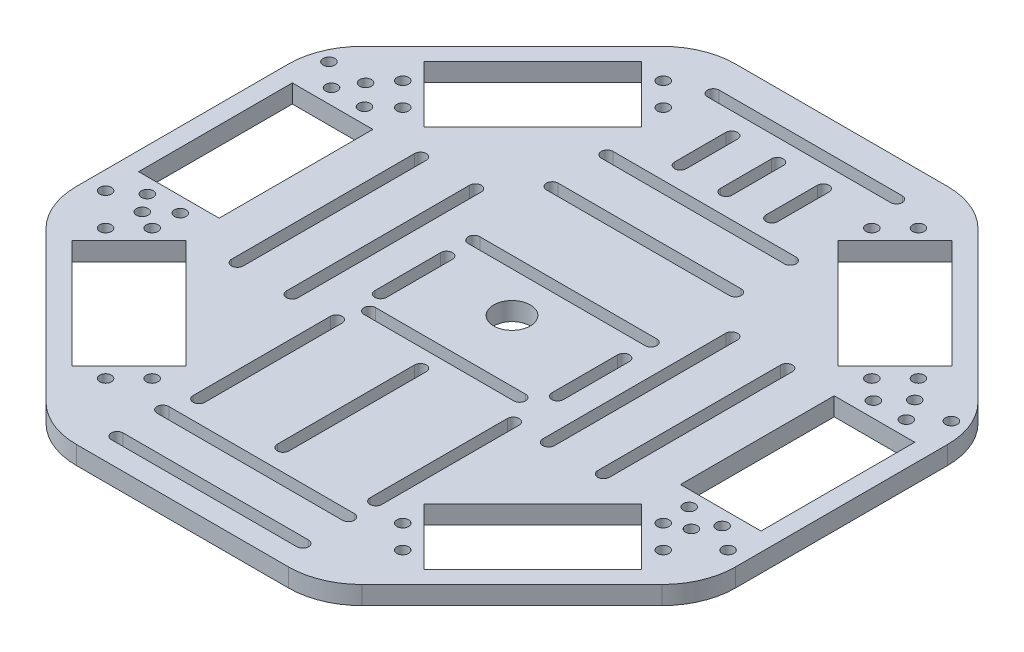
from build123d import *

# Parameters (mm, degrees)
BASEPLATE_DEPTH            = 5
FILLET1_R                  = 20
SKETCH2_R                  = 1.6
SKETCH2_W                  = 22
SKETCH2_H                  = 42
SERVO_HOLE_DEPTH           = 128.377392029
SKETCH3_R                  = 5
CENTER_HOLE_DEPTH          = 128.377392029
SERVO_HOLE_PATTERN_COUNT   = 8
SKETCH4_R                  = 1.6
ARDUINO_SCREW_HOLES_DEPTH  = 128.377392029
MIRROR1_COPY_1_SKETCH_R    = 1.6
MIRROR1_COPY_1_SKETCH_W    = 22
MIRROR1_COPY_1_SKETCH_H    = 42
MIRROR1_COPY_1_DEPTH       = 128.377392029
MIRROR1_COPY_2_SKETCH_R    = 1.6
MIRROR1_COPY_2_SKETCH_W    = 22
MIRROR1_COPY_2_SKETCH_H    = 42
MIRROR1_COPY_2_DEPTH       = 128.377392029
SLITS_DEPTH                = 128.377392029
SKETCH6_R                  = 1.6
EXTERIOR_SCREW_HOLES_DEPTH = 128.377392029
SKETCH7_R                  = 1.6
CUT_EXTRUDE1_DEPTH         = 128.377392029
CUT_EXTRUDE2_DEPTH         = 128.377392029


with BuildPart() as part:
    # Sketch1 → Baseplate (new body)
    with BuildSketch(Plane(origin=(0, 0, 0), x_dir=(1, 0, 0), z_dir=(0, 1, 0))):
        Polygon((-90, -37.279220614), (-37.279220614, -90), (37.279220614, -90), (90, -37.279220614), (90, 37.279220614), (37.279220614, 90), (-37.279220614, 90), (-90, 37.279220614), align=None)
    extrude(amount=BASEPLATE_DEPTH)

    # Fillet1
    fillet1_edges = [part.edges().sort_by_distance(p)[0] for p in [
        (-37.279220614, 2.5, -90),
        (37.279220614, 2.5, -90),
        (90, 2.5, -37.279220614),
        (90, 2.5, 37.279220614),
        (37.279220614, 2.5, 90),
        (-37.279220614, 2.5, 90),
        (-90, 2.5, 37.279220614),
        (-90, 2.5, -37.279220614),
    ]]
    fillet(fillet1_edges, radius=FILLET1_R)

    # Sketch2 → Servo hole (cut, through all)
    with BuildSketch(Plane(origin=(0, 5, 0), x_dir=(1, 0, 0), z_dir=(0, 1, 0))):
        with Locations(Location((78.5, 29.205050634, 0), (0, 0, 270))):
            Circle(SKETCH2_R)
        with Locations((74, 4.005050634)):
            Rectangle(SKETCH2_W, SKETCH2_H)
        with Locations(Location((69.5, -21.094949366, 0), (0, 0, 270))):
            Circle(SKETCH2_R)
        with Locations(Location((78.5, -21.094949366, 0), (0, 0, 270))):
            Circle(SKETCH2_R)
        with Locations(Location((69.5, 29.205050634, 0), (0, 0, 270))):
            Circle(SKETCH2_R)
    servo_hole = extrude(amount=-SERVO_HOLE_DEPTH, mode=Mode.SUBTRACT)

    # Sketch3 → Center hole (cut, through all)
    with BuildSketch(Plane(origin=(0, 5, 0), x_dir=(1, 0, 0), z_dir=(0, 1, 0))):
        with Locations(Location((0, 0, 0), (0, 0, 270))):
            Circle(SKETCH3_R)
    extrude(amount=-CENTER_HOLE_DEPTH, mode=Mode.SUBTRACT)

    # Servo hole pattern: Servo hole ×8 about axis, 5 skipped
    servo_hole_pattern_axis = Axis((0, 0, 0), (0, 1, 0))
    add([servo_hole.rotate(servo_hole_pattern_axis, i * 360 / SERVO_HOLE_PATTERN_COUNT) for i in range(1, SERVO_HOLE_PATTERN_COUNT) if i not in (2, 3, 4, 5, 6)], mode=Mode.SUBTRACT)

    # Sketch4 → Arduino Screw holes (cut, through all)
    with BuildSketch(Plane(origin=(0, 5, 0), x_dir=(1, 0, 0), z_dir=(0, 1, 0))):
        with Locations(Location((-23, 5.1332, 0), (0, 0, 270))):
            Circle(SKETCH4_R)
        with Locations(Location((-23, -70, 0), (0, 0, 270))):
            Circle(SKETCH4_R)
        with Locations(Location((25.3362, 12.6262, 0), (0, 0, 270))):
            Circle(SKETCH4_R)
        with Locations(Location((25.3362, -70, 0), (0, 0, 270))):
            Circle(SKETCH4_R)
        with Locations(Location((-7.55849277, -18.3745, 0), (0, 0, 270))):
            Circle(SKETCH4_R)
        with Locations(Location((20.45770723, -18.3745, 0), (0, 0, 270))):
            Circle(SKETCH4_R)
    extrude(amount=-ARDUINO_SCREW_HOLES_DEPTH, mode=Mode.SUBTRACT)

    # Mirror1: Servo hole across plane
    add(servo_hole.mirror(Plane(origin=(0, 0, 0), x_dir=(0, 0, 1), z_dir=(1, 0, 0))), mode=Mode.SUBTRACT)

    # Mirror1 copy 1 sketch → Mirror1 copy 1 (cut, through all)
    with BuildSketch(Plane(origin=(0, 5, 0), x_dir=(-0.7071067811865476, 0, -0.7071067811865475), z_dir=(0, 1, 0))):
        with Locations((78.5, -29.205050634)):
            Circle(MIRROR1_COPY_1_SKETCH_R)
        with Locations((74, -4.005050634)):
            Rectangle(MIRROR1_COPY_1_SKETCH_W, MIRROR1_COPY_1_SKETCH_H)
        with Locations((69.5, 21.094949366)):
            Circle(MIRROR1_COPY_1_SKETCH_R)
        with Locations((78.5, 21.094949366)):
            Circle(MIRROR1_COPY_1_SKETCH_R)
        with Locations((69.5, -29.205050634)):
            Circle(MIRROR1_COPY_1_SKETCH_R)
    extrude(amount=-MIRROR1_COPY_1_DEPTH, mode=Mode.SUBTRACT)

    # Mirror1 copy 2 sketch → Mirror1 copy 2 (cut, through all)
    with BuildSketch(Plane(origin=(0, 5, 0), x_dir=(-0.7071067811865474, 0, 0.7071067811865477), z_dir=(0, 1, 0))):
        with Locations((78.5, -29.205050634)):
            Circle(MIRROR1_COPY_2_SKETCH_R)
        with Locations((74, -4.005050634)):
            Rectangle(MIRROR1_COPY_2_SKETCH_W, MIRROR1_COPY_2_SKETCH_H)
        with Locations((69.5, 21.094949366)):
            Circle(MIRROR1_COPY_2_SKETCH_R)
        with Locations((78.5, 21.094949366)):
            Circle(MIRROR1_COPY_2_SKETCH_R)
        with Locations((69.5, -29.205050634)):
            Circle(MIRROR1_COPY_2_SKETCH_R)
    extrude(amount=-MIRROR1_COPY_2_DEPTH, mode=Mode.SUBTRACT)

    # Sketch5 → Slits (cut, through all)
    with BuildSketch(Plane(origin=(0, 5, 0), x_dir=(1, 0, 0), z_dir=(0, 1, 0))):
        with BuildLine():
            Line((-1.6, 72.5), (-1.6, 58.5))
            ThreePointArc((-1.6, 58.5), (0, 56.9), (1.6, 58.5))
            Line((1.6, 58.5), (1.6, 72.5))
            ThreePointArc((1.6, 72.5), (0, 74.1), (-1.6, 72.5))
        make_face()
        with BuildLine():
            Line((10.9, 72.5), (10.9, 58.5))
            ThreePointArc((10.9, 58.5), (12.5, 56.9), (14.1, 58.5))
            Line((14.1, 58.5), (14.1, 72.5))
            ThreePointArc((14.1, 72.5), (12.5, 74.1), (10.9, 72.5))
        make_face()
        with BuildLine():
            Line((-25, 49.4), (25, 49.4))
            ThreePointArc((25, 49.4), (26.6, 51), (25, 52.6))
            Line((25, 52.6), (-25, 52.6))
            ThreePointArc((-25, 52.6), (-26.6, 51), (-25, 49.4))
        make_face()
        with BuildLine():
            Line((-25, 34.4), (25, 34.4))
            ThreePointArc((25, 34.4), (26.6, 36), (25, 37.6))
            Line((25, 37.6), (-25, 37.6))
            ThreePointArc((-25, 37.6), (-26.6, 36), (-25, 34.4))
        make_face()
        with BuildLine():
            Line((-51.6, 25), (-51.6, -25))
            ThreePointArc((-51.6, -25), (-50, -26.6), (-48.4, -25))
            Line((-48.4, -25), (-48.4, 25))
            ThreePointArc((-48.4, 25), (-50, 26.6), (-51.6, 25))
        make_face()
        with BuildLine():
            Line((-36.6, 25), (-36.6, -25))
            ThreePointArc((-36.6, -25), (-35, -26.6), (-33.4, -25))
            Line((-33.4, -25), (-33.4, 25))
            ThreePointArc((-33.4, 25), (-35, 26.6), (-36.6, 25))
        make_face()
        with BuildLine():
            Line((33.4, 25), (33.4, -25))
            ThreePointArc((33.4, -25), (35, -26.6), (36.6, -25))
            Line((36.6, -25), (36.6, 25))
            ThreePointArc((36.6, 25), (35, 26.6), (33.4, 25))
        make_face()
        with BuildLine():
            Line((48.4, 25), (48.4, -25))
            ThreePointArc((48.4, -25), (50, -26.6), (51.6, -25))
            Line((51.6, -25), (51.6, 25))
            ThreePointArc((51.6, 25), (50, 26.6), (48.4, 25))
        make_face()
        with BuildLine():
            Line((-25, 81.6), (25, 81.6))
            ThreePointArc((25, 81.6), (26.6, 80), (25, 78.4))
            Line((25, 78.4), (-25, 78.4))
            ThreePointArc((-25, 78.4), (-26.6, 80), (-25, 81.6))
        make_face()
        with BuildLine():
            Line((-10.9, 72.5), (-10.9, 58.5))
            ThreePointArc((-10.9, 58.5), (-12.5, 56.9), (-14.1, 58.5))
            Line((-14.1, 58.5), (-14.1, 72.5))
            ThreePointArc((-14.1, 72.5), (-12.5, 74.1), (-10.9, 72.5))
        make_face()
    extrude(amount=-SLITS_DEPTH, mode=Mode.SUBTRACT)

    # Sketch6 → Exterior Screw Holes (cut, through all)
    with BuildSketch(Plane(origin=(0, 5, 0), x_dir=(1, 0, 0), z_dir=(0, 1, 0))):
        with Locations(Location((-75, 35, 0), (0, 0, 270))):
            Circle(SKETCH6_R)
        with Locations(Location((-85, 35, 0), (0, 0, 270))):
            Circle(SKETCH6_R)
    exterior_screw_holes = extrude(amount=-EXTERIOR_SCREW_HOLES_DEPTH, mode=Mode.SUBTRACT)

    # Mirror2: Exterior Screw Holes across plane
    add(exterior_screw_holes.mirror(Plane(origin=(0, 0, 0), x_dir=(0, 0, 1), z_dir=(1, 0, 0))), mode=Mode.SUBTRACT)

    # Sketch7 → Cut-Extrude1 (cut, through all)
    with BuildSketch(Plane(origin=(0, 5, 0), x_dir=(1, 0, 0), z_dir=(0, 1, 0))):
        with Locations(Location((-75, -26, 0), (0, 0, 270))):
            Circle(SKETCH7_R)
        with Locations(Location((-85, -26, 0), (0, 0, 270))):
            Circle(SKETCH7_R)
    cut_extrude1 = extrude(amount=-CUT_EXTRUDE1_DEPTH, mode=Mode.SUBTRACT)

    # Mirror3: Cut-Extrude1 across plane
    add(cut_extrude1.mirror(Plane(origin=(0, 0, 0), x_dir=(0, 0, 1), z_dir=(1, 0, 0))), mode=Mode.SUBTRACT)

    # Sketch8 → Cut-Extrude2 (cut, through all)
    with BuildSketch(Plane(origin=(0, 5, 0), x_dir=(1, 0, 0), z_dir=(0, 1, 0))):
        with BuildLine():
            Line((-21.4, -12.8668), (-21.4, 5.1332))
            ThreePointArc((-21.4, 5.1332), (-23, 6.7332), (-24.6, 5.1332))
            Line((-24.6, 5.1332), (-24.6, -12.8668))
            ThreePointArc((-24.6, -12.8668), (-23, -14.4668), (-21.4, -12.8668))
        make_face()
        with BuildLine():
            Line((23.7362, 5.1332), (23.7362, -12.8668))
            ThreePointArc((23.7362, -12.8668), (25.3362, -14.4668), (26.9362, -12.8668))
            Line((26.9362, -12.8668), (26.9362, 5.1332))
            ThreePointArc((26.9362, 5.1332), (25.3362, 6.7332), (23.7362, 5.1332))
        make_face()
        with BuildLine():
            Line((20.45770723, -16.7745), (-20.45770723, -16.7745))
            ThreePointArc((-20.45770723, -16.7745), (-22.05770723, -18.3745), (-20.45770723, -19.9745))
            Line((-20.45770723, -19.9745), (20.45770723, -19.9745))
            ThreePointArc((20.45770723, -19.9745), (22.05770723, -18.3745), (20.45770723, -16.7745))
        make_face()
        with BuildLine():
            Line((1.6, -62.5), (1.6, -25))
            ThreePointArc((1.6, -25), (0, -23.4), (-1.6, -25))
            Line((-1.6, -25), (-1.6, -62.5))
            ThreePointArc((-1.6, -62.5), (0, -64.1), (1.6, -62.5))
        make_face()
        with BuildLine():
            Line((26.9362, -62.5), (26.9362, -25))
            ThreePointArc((26.9362, -25), (25.3362, -23.4), (23.7362, -25))
            Line((23.7362, -25), (23.7362, -62.5))
            ThreePointArc((23.7362, -62.5), (25.3362, -64.1), (26.9362, -62.5))
        make_face()
        with BuildLine():
            Line((-25.3362, -84.1), (25.3362, -84.1))
            ThreePointArc((25.3362, -84.1), (26.9362, -82.5), (25.3362, -80.9))
            Line((25.3362, -80.9), (-25.3362, -80.9))
            ThreePointArc((-25.3362, -80.9), (-26.9362, -82.5), (-25.3362, -84.1))
        make_face()
        with BuildLine():
            Line((25.3362, 14.2262), (-23, 14.2262))
            ThreePointArc((-23, 14.2262), (-24.6, 12.6262), (-23, 11.0262))
            Line((-23, 11.0262), (25.3362, 11.0262))
            ThreePointArc((25.3362, 11.0262), (26.9362, 12.6262), (25.3362, 14.2262))
        make_face()
        with BuildLine():
            Line((-21.4, -25), (-21.4, -62.5))
            ThreePointArc((-21.4, -62.5), (-23, -64.1), (-24.6, -62.5))
            Line((-24.6, -62.5), (-24.6, -25))
            ThreePointArc((-24.6, -25), (-23, -23.4), (-21.4, -25))
        make_face()
        with BuildLine():
            Line((-25.3362, -68.4), (25.3362, -68.4))
            ThreePointArc((25.3362, -68.4), (26.9362, -70), (25.3362, -71.6))
            Line((25.3362, -71.6), (-25.3362, -71.6))
            ThreePointArc((-25.3362, -71.6), (-26.9362, -70), (-25.3362, -68.4))
        make_face()
    extrude(amount=-CUT_EXTRUDE2_DEPTH, mode=Mode.SUBTRACT)


solid = part.part
